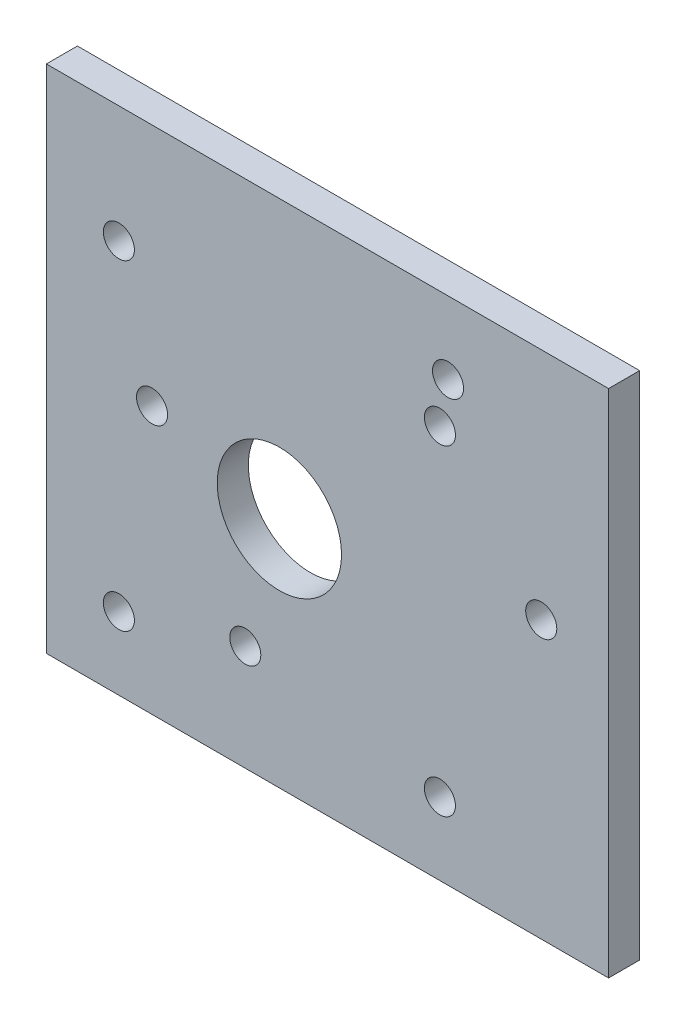
from build123d import *

# Parameters (mm, degrees)
SKETCH1_W           = 45
SKETCH1_H           = 45
SKETCH1_R           = 6
BOSS_EXTRUDE1_DEPTH = 1.5
SKETCH4_W           = 3
SKETCH4_H           = 45
BOSS_EXTRUDE2_DEPTH = 20
SKETCH2_R           = 1.5
CUT_EXTRUDE1_DEPTH  = 5
SKETCH3_R           = 1.5
CUT_EXTRUDE2_DEPTH  = 5
SKETCH5_W           = 65
SKETCH5_H           = 3
BOSS_EXTRUDE3_DEPTH = 4.29
SKETCH6_W           = 10.715390309
SKETCH6_H           = 49.29
CUT_EXTRUDE3_DEPTH  = 4.29


with BuildPart() as part:
    # Sketch1 → Boss-Extrude1 (new, symmetric)
    with BuildSketch(Plane.XY):
        Rectangle(SKETCH1_W, SKETCH1_H)
        Circle(SKETCH1_R, mode=Mode.SUBTRACT)
    extrude(amount=BOSS_EXTRUDE1_DEPTH, both=True)

    # Sketch4 → Boss-Extrude2 (add)
    with BuildSketch(Plane(origin=(22.5, 0, 0), x_dir=(0, 0, -1), z_dir=(1, 0, 0))):
        Rectangle(SKETCH4_W, SKETCH4_H)
    extrude(amount=BOSS_EXTRUDE2_DEPTH)

    # Sketch2 → Cut-Extrude1 (cut, symmetric)
    with BuildSketch(Plane.XY.offset(1.5)):
        with Locations((-15.5, 15.5)):
            Circle(SKETCH2_R)
        with Locations((15.5, 15.5)):
            Circle(SKETCH2_R)
        with Locations((15.5, -15.5)):
            Circle(SKETCH2_R)
        with Locations((-15.5, -15.5)):
            Circle(SKETCH2_R)
    extrude(amount=CUT_EXTRUDE1_DEPTH, both=True, mode=Mode.SUBTRACT)

    # Sketch3 → Cut-Extrude2 (cut, symmetric)
    with BuildSketch(Plane.XY.offset(1.5)):
        with Locations((-3.294228634, -12.294228634)):
            Circle(SKETCH3_R)
        with Locations((25.284609691, 4.205771366)):
            Circle(SKETCH3_R)
        with Locations((16.284609691, 19.794228634)):
            Circle(SKETCH3_R)
        with Locations((-12.294228634, 3.294228634)):
            Circle(SKETCH3_R)
    extrude(amount=CUT_EXTRUDE2_DEPTH, both=True, mode=Mode.SUBTRACT)

    # Sketch5 → Boss-Extrude3 (add)
    with BuildSketch(Plane(origin=(0, 22.5, 0), x_dir=(1, 0, 0), z_dir=(0, 1, 0))):
        with Locations((10, 0)):
            Rectangle(SKETCH5_W, SKETCH5_H)
    extrude(amount=BOSS_EXTRUDE3_DEPTH)

    # Sketch6 → Cut-Extrude3 (cut)
    with BuildSketch(Plane.XY.offset(1.5)):
        with Locations((37.142304845, 2.145)):
            Rectangle(SKETCH6_W, SKETCH6_H)
    extrude(amount=-CUT_EXTRUDE3_DEPTH, mode=Mode.SUBTRACT)


solid = part.part
